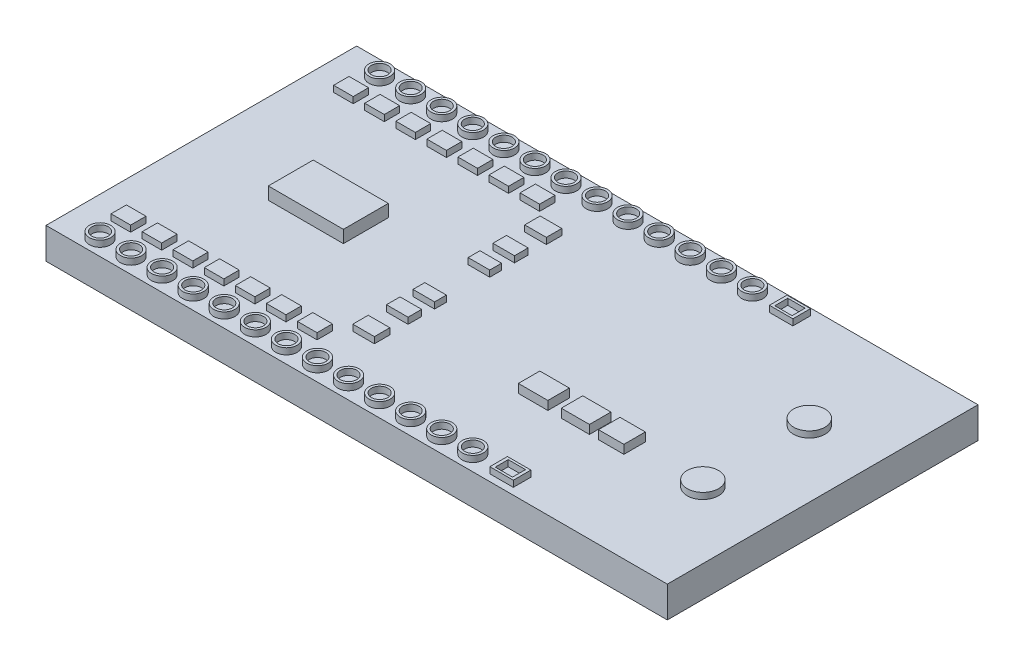
from build123d import *

# Parameters (mm, degrees)
SKETCH1_W           = 50
SKETCH1_H           = 25
BOSS_EXTRUDE1_DEPTH = 2.5
SKETCH2_R           = 0.858035348
SKETCH2_R_2         = 0.658546008
SKETCH2_R_3         = 1.264768735
SKETCH2_W           = 1.886042072
SKETCH2_H           = 1.41485527
SKETCH2_W_2         = 1.393060959
SKETCH2_H_2         = 1.045034821
SKETCH2_W_3         = 1.574978579
SKETCH2_H_3         = 1.234694693
SKETCH2_W_4         = 1.738750891
SKETCH2_H_4         = 1.242501406
SKETCH2_H_5         = 1.09279236
SKETCH2_H_6         = 0.95172598
BOSS_EXTRUDE2_DEPTH = 0.5
SKETCH3_W           = 6.042421404
SKETCH3_H           = 3.614662804
BOSS_EXTRUDE3_DEPTH = 1
SKETCH4_W           = 2.373808409
SKETCH4_H           = 1.726406116
SKETCH4_W_2         = 2.265908026
SKETCH4_W_3         = 2.040115156
BOSS_EXTRUDE4_DEPTH = 0.7


with BuildPart() as part:
    # Sketch1 → Boss-Extrude1 (new body)
    with BuildSketch(Plane(origin=(0, 0, 0), x_dir=(1, 0, 0), z_dir=(0, 1, 0))):
        Rectangle(SKETCH1_W, SKETCH1_H)
    extrude(amount=BOSS_EXTRUDE1_DEPTH)

    # Sketch2 → Boss-Extrude2 (add)
    # profile 1 of 50: a face of its own
    with BuildSketch(Plane(origin=(0, 2.5, 0), x_dir=(1, 0, 0), z_dir=(0, 1, 0))):
        with Locations(Location((-21.903777588, 11.248614845, 0), (0, 0, 270))):
            Circle(SKETCH2_R)
        with Locations(Location((-21.903777588, 11.248614845, 0), (0, 0, 270))):
            Circle(SKETCH2_R_2, mode=Mode.SUBTRACT)
    # profile 2 of 50: a face of its own
    with BuildSketch(Plane(origin=(0, 2.5, 0), x_dir=(1, 0, 0), z_dir=(0, 1, 0))):
        with Locations(Location((-19.403777588, 11.248614845, 0), (0, 0, 270))):
            Circle(SKETCH2_R)
        with Locations(Location((-19.403777588, 11.248614845, 0), (0, 0, 270))):
            Circle(SKETCH2_R_2, mode=Mode.SUBTRACT)
    # profile 3 of 50: a face of its own
    with BuildSketch(Plane(origin=(0, 2.5, 0), x_dir=(1, 0, 0), z_dir=(0, 1, 0))):
        with Locations(Location((-16.903777588, 11.248614845, 0), (0, 0, 270))):
            Circle(SKETCH2_R)
        with Locations(Location((-16.903777588, 11.248614845, 0), (0, 0, 270))):
            Circle(SKETCH2_R_2, mode=Mode.SUBTRACT)
    # profile 4 of 50: a face of its own
    with BuildSketch(Plane(origin=(0, 2.5, 0), x_dir=(1, 0, 0), z_dir=(0, 1, 0))):
        with Locations(Location((-14.403777588, 11.248614845, 0), (0, 0, 270))):
            Circle(SKETCH2_R)
        with Locations(Location((-14.403777588, 11.248614845, 0), (0, 0, 270))):
            Circle(SKETCH2_R_2, mode=Mode.SUBTRACT)
    # profile 5 of 50: a face of its own
    with BuildSketch(Plane(origin=(0, 2.5, 0), x_dir=(1, 0, 0), z_dir=(0, 1, 0))):
        with Locations(Location((-11.903777588, 11.248614845, 0), (0, 0, 270))):
            Circle(SKETCH2_R)
        with Locations(Location((-11.903777588, 11.248614845, 0), (0, 0, 270))):
            Circle(SKETCH2_R_2, mode=Mode.SUBTRACT)
    # profile 6 of 50: a face of its own
    with BuildSketch(Plane(origin=(0, 2.5, 0), x_dir=(1, 0, 0), z_dir=(0, 1, 0))):
        with Locations(Location((-9.403777588, 11.248614845, 0), (0, 0, 270))):
            Circle(SKETCH2_R)
        with Locations(Location((-9.403777588, 11.248614845, 0), (0, 0, 270))):
            Circle(SKETCH2_R_2, mode=Mode.SUBTRACT)
    # profile 7 of 50: a face of its own
    with BuildSketch(Plane(origin=(0, 2.5, 0), x_dir=(1, 0, 0), z_dir=(0, 1, 0))):
        with Locations(Location((-6.903777588, 11.248614845, 0), (0, 0, 270))):
            Circle(SKETCH2_R)
        with Locations(Location((-6.903777588, 11.248614845, 0), (0, 0, 270))):
            Circle(SKETCH2_R_2, mode=Mode.SUBTRACT)
    # profile 8 of 50: a face of its own
    with BuildSketch(Plane(origin=(0, 2.5, 0), x_dir=(1, 0, 0), z_dir=(0, 1, 0))):
        with Locations(Location((-4.403777588, 11.248614845, 0), (0, 0, 270))):
            Circle(SKETCH2_R)
        with Locations(Location((-4.403777588, 11.248614845, 0), (0, 0, 270))):
            Circle(SKETCH2_R_2, mode=Mode.SUBTRACT)
    # profile 9 of 50: a face of its own
    with BuildSketch(Plane(origin=(0, 2.5, 0), x_dir=(1, 0, 0), z_dir=(0, 1, 0))):
        with Locations(Location((-1.903777588, 11.248614845, 0), (0, 0, 270))):
            Circle(SKETCH2_R)
        with Locations(Location((-1.903777588, 11.248614845, 0), (0, 0, 270))):
            Circle(SKETCH2_R_2, mode=Mode.SUBTRACT)
    # profile 10 of 50: a face of its own
    with BuildSketch(Plane(origin=(0, 2.5, 0), x_dir=(1, 0, 0), z_dir=(0, 1, 0))):
        with Locations(Location((0.596222412, 11.248614845, 0), (0, 0, 270))):
            Circle(SKETCH2_R)
        with Locations(Location((0.596222412, 11.248614845, 0), (0, 0, 270))):
            Circle(SKETCH2_R_2, mode=Mode.SUBTRACT)
    # profile 11 of 50: a face of its own
    with BuildSketch(Plane(origin=(0, 2.5, 0), x_dir=(1, 0, 0), z_dir=(0, 1, 0))):
        with Locations(Location((3.096222412, 11.248614845, 0), (0, 0, 270))):
            Circle(SKETCH2_R)
        with Locations(Location((3.096222412, 11.248614845, 0), (0, 0, 270))):
            Circle(SKETCH2_R_2, mode=Mode.SUBTRACT)
    # profile 12 of 50: a face of its own
    with BuildSketch(Plane(origin=(0, 2.5, 0), x_dir=(1, 0, 0), z_dir=(0, 1, 0))):
        with Locations(Location((5.596222412, 11.248614845, 0), (0, 0, 270))):
            Circle(SKETCH2_R)
        with Locations(Location((5.596222412, 11.248614845, 0), (0, 0, 270))):
            Circle(SKETCH2_R_2, mode=Mode.SUBTRACT)
    # profile 13 of 50: a face of its own
    with BuildSketch(Plane(origin=(0, 2.5, 0), x_dir=(1, 0, 0), z_dir=(0, 1, 0))):
        with Locations(Location((8.096222412, 11.248614845, 0), (0, 0, 270))):
            Circle(SKETCH2_R)
        with Locations(Location((8.096222412, 11.248614845, 0), (0, 0, 270))):
            Circle(SKETCH2_R_2, mode=Mode.SUBTRACT)
    # profile 14 of 50: a face of its own
    with BuildSketch(Plane(origin=(0, 2.5, 0), x_dir=(1, 0, 0), z_dir=(0, 1, 0))):
        with Locations(Location((-9.403777588, -11.248614845, 0), (0, 0, 90))):
            Circle(SKETCH2_R)
        with Locations(Location((-9.403777588, -11.248614845, 0), (0, 0, 90))):
            Circle(SKETCH2_R_2, mode=Mode.SUBTRACT)
    # profile 15 of 50: a face of its own
    with BuildSketch(Plane(origin=(0, 2.5, 0), x_dir=(1, 0, 0), z_dir=(0, 1, 0))):
        with Locations(Location((-11.903777588, -11.248614845, 0), (0, 0, 90))):
            Circle(SKETCH2_R)
        with Locations(Location((-11.903777588, -11.248614845, 0), (0, 0, 90))):
            Circle(SKETCH2_R_2, mode=Mode.SUBTRACT)
    # profile 16 of 50: a face of its own
    with BuildSketch(Plane(origin=(0, 2.5, 0), x_dir=(1, 0, 0), z_dir=(0, 1, 0))):
        with Locations(Location((-14.403777588, -11.248614845, 0), (0, 0, 90))):
            Circle(SKETCH2_R)
        with Locations(Location((-14.403777588, -11.248614845, 0), (0, 0, 90))):
            Circle(SKETCH2_R_2, mode=Mode.SUBTRACT)
    # profile 17 of 50: a face of its own
    with BuildSketch(Plane(origin=(0, 2.5, 0), x_dir=(1, 0, 0), z_dir=(0, 1, 0))):
        with Locations(Location((-16.903777588, -11.248614845, 0), (0, 0, 90))):
            Circle(SKETCH2_R)
        with Locations(Location((-16.903777588, -11.248614845, 0), (0, 0, 90))):
            Circle(SKETCH2_R_2, mode=Mode.SUBTRACT)
    # profile 18 of 50: a face of its own
    with BuildSketch(Plane(origin=(0, 2.5, 0), x_dir=(1, 0, 0), z_dir=(0, 1, 0))):
        with Locations(Location((-19.403777588, -11.248614845, 0), (0, 0, 90))):
            Circle(SKETCH2_R)
        with Locations(Location((-19.403777588, -11.248614845, 0), (0, 0, 90))):
            Circle(SKETCH2_R_2, mode=Mode.SUBTRACT)
    # profile 19 of 50: a face of its own
    with BuildSketch(Plane(origin=(0, 2.5, 0), x_dir=(1, 0, 0), z_dir=(0, 1, 0))):
        with Locations(Location((-21.903777588, -11.248614845, 0), (0, 0, 90))):
            Circle(SKETCH2_R)
        with Locations(Location((-21.903777588, -11.248614845, 0), (0, 0, 90))):
            Circle(SKETCH2_R_2, mode=Mode.SUBTRACT)
    # profile 20 of 50: a face of its own
    with BuildSketch(Plane(origin=(0, 2.5, 0), x_dir=(1, 0, 0), z_dir=(0, 1, 0))):
        with Locations(Location((5.596222412, -11.248614845, 0), (0, 0, 90))):
            Circle(SKETCH2_R)
        with Locations(Location((5.596222412, -11.248614845, 0), (0, 0, 90))):
            Circle(SKETCH2_R_2, mode=Mode.SUBTRACT)
    # profile 21 of 50: a face of its own
    with BuildSketch(Plane(origin=(0, 2.5, 0), x_dir=(1, 0, 0), z_dir=(0, 1, 0))):
        with Locations(Location((8.096222412, -11.248614845, 0), (0, 0, 90))):
            Circle(SKETCH2_R)
        with Locations(Location((8.096222412, -11.248614845, 0), (0, 0, 90))):
            Circle(SKETCH2_R_2, mode=Mode.SUBTRACT)
    # profile 22 of 50: a face of its own
    with BuildSketch(Plane(origin=(0, 2.5, 0), x_dir=(1, 0, 0), z_dir=(0, 1, 0))):
        with Locations(Location((3.096222412, -11.248614845, 0), (0, 0, 90))):
            Circle(SKETCH2_R)
        with Locations(Location((3.096222412, -11.248614845, 0), (0, 0, 90))):
            Circle(SKETCH2_R_2, mode=Mode.SUBTRACT)
    # profile 23 of 50: a face of its own
    with BuildSketch(Plane(origin=(0, 2.5, 0), x_dir=(1, 0, 0), z_dir=(0, 1, 0))):
        with Locations(Location((0.596222412, -11.248614845, 0), (0, 0, 90))):
            Circle(SKETCH2_R)
        with Locations(Location((0.596222412, -11.248614845, 0), (0, 0, 90))):
            Circle(SKETCH2_R_2, mode=Mode.SUBTRACT)
    # profile 24 of 50: a face of its own
    with BuildSketch(Plane(origin=(0, 2.5, 0), x_dir=(1, 0, 0), z_dir=(0, 1, 0))):
        with Locations(Location((-1.903777588, -11.248614845, 0), (0, 0, 90))):
            Circle(SKETCH2_R)
        with Locations(Location((-1.903777588, -11.248614845, 0), (0, 0, 90))):
            Circle(SKETCH2_R_2, mode=Mode.SUBTRACT)
    # profile 25 of 50: a face of its own
    with BuildSketch(Plane(origin=(0, 2.5, 0), x_dir=(1, 0, 0), z_dir=(0, 1, 0))):
        with Locations(Location((-4.403777588, -11.248614845, 0), (0, 0, 90))):
            Circle(SKETCH2_R)
        with Locations(Location((-4.403777588, -11.248614845, 0), (0, 0, 90))):
            Circle(SKETCH2_R_2, mode=Mode.SUBTRACT)
    # profile 26 of 50: a face of its own
    with BuildSketch(Plane(origin=(0, 2.5, 0), x_dir=(1, 0, 0), z_dir=(0, 1, 0))):
        with Locations(Location((-6.903777588, -11.248614845, 0), (0, 0, 90))):
            Circle(SKETCH2_R)
        with Locations(Location((-6.903777588, -11.248614845, 0), (0, 0, 90))):
            Circle(SKETCH2_R_2, mode=Mode.SUBTRACT)
    # profile 27 of 50: a face of its own
    with BuildSketch(Plane(origin=(0, 2.5, 0), x_dir=(1, 0, 0), z_dir=(0, 1, 0))):
        with Locations(Location((19.642223726, 4.282710717, 0), (0, 0, 270))):
            Circle(SKETCH2_R_3)
    # profile 28 of 50: a face of its own
    with BuildSketch(Plane(origin=(0, 2.5, 0), x_dir=(1, 0, 0), z_dir=(0, 1, 0))):
        with Locations(Location((19.642223726, -4.282710717, 0), (0, 0, 90))):
            Circle(SKETCH2_R_3)
    # profile 29 of 50: a face of its own
    with BuildSketch(Plane(origin=(0, 2.5, 0), x_dir=(1, 0, 0), z_dir=(0, 1, 0))):
        with Locations((11.117000575, 11.248614845)):
            Rectangle(SKETCH2_W, SKETCH2_H)
        with Locations((11.117000576, 11.248614846)):
            Rectangle(SKETCH2_W_2, SKETCH2_H_2, mode=Mode.SUBTRACT)
    # profile 30 of 50: a face of its own
    with BuildSketch(Plane(origin=(0, 2.5, 0), x_dir=(1, 0, 0), z_dir=(0, 1, 0))):
        with Locations((11.117000575, -11.248614845)):
            Rectangle(SKETCH2_W, SKETCH2_H)
        with Locations((11.117000576, -11.248614846)):
            Rectangle(SKETCH2_W_2, SKETCH2_H_2, mode=Mode.SUBTRACT)
    # profile 31 of 50: a face of its own
    with BuildSketch(Plane(origin=(0, 2.5, 0), x_dir=(1, 0, 0), z_dir=(0, 1, 0))):
        with Locations((-19.403777588, 8.956286559)):
            Rectangle(SKETCH2_W_3, SKETCH2_H_3)
    # profile 32 of 50: a face of its own
    with BuildSketch(Plane(origin=(0, 2.5, 0), x_dir=(1, 0, 0), z_dir=(0, 1, 0))):
        with Locations((-21.903777588, 8.956286559)):
            Rectangle(SKETCH2_W_3, SKETCH2_H_3)
    # profile 33 of 50: a face of its own
    with BuildSketch(Plane(origin=(0, 2.5, 0), x_dir=(1, 0, 0), z_dir=(0, 1, 0))):
        with Locations((-16.903777588, 8.956286559)):
            Rectangle(SKETCH2_W_3, SKETCH2_H_3)
    # profile 34 of 50: a face of its own
    with BuildSketch(Plane(origin=(0, 2.5, 0), x_dir=(1, 0, 0), z_dir=(0, 1, 0))):
        with Locations((-14.403777589, 8.956286559)):
            Rectangle(SKETCH2_W_3, SKETCH2_H_3)
    # profile 35 of 50: a face of its own
    with BuildSketch(Plane(origin=(0, 2.5, 0), x_dir=(1, 0, 0), z_dir=(0, 1, 0))):
        with Locations((-11.903777589, 8.956286559)):
            Rectangle(SKETCH2_W_3, SKETCH2_H_3)
    # profile 36 of 50: a face of its own
    with BuildSketch(Plane(origin=(0, 2.5, 0), x_dir=(1, 0, 0), z_dir=(0, 1, 0))):
        with Locations((-9.403777589, 8.956286559)):
            Rectangle(SKETCH2_W_3, SKETCH2_H_3)
    # profile 37 of 50: a face of its own
    with BuildSketch(Plane(origin=(0, 2.5, 0), x_dir=(1, 0, 0), z_dir=(0, 1, 0))):
        with Locations((-6.903777589, 8.956286559)):
            Rectangle(SKETCH2_W_3, SKETCH2_H_3)
    # profile 38 of 50: a face of its own
    with BuildSketch(Plane(origin=(0, 2.5, 0), x_dir=(1, 0, 0), z_dir=(0, 1, 0))):
        with Locations((-6.903777589, -8.956286559)):
            Rectangle(SKETCH2_W_3, SKETCH2_H_3)
    # profile 39 of 50: a face of its own
    with BuildSketch(Plane(origin=(0, 2.5, 0), x_dir=(1, 0, 0), z_dir=(0, 1, 0))):
        with Locations((-9.403777589, -8.956286559)):
            Rectangle(SKETCH2_W_3, SKETCH2_H_3)
    # profile 40 of 50: a face of its own
    with BuildSketch(Plane(origin=(0, 2.5, 0), x_dir=(1, 0, 0), z_dir=(0, 1, 0))):
        with Locations((-11.903777589, -8.956286559)):
            Rectangle(SKETCH2_W_3, SKETCH2_H_3)
    # profile 41 of 50: a face of its own
    with BuildSketch(Plane(origin=(0, 2.5, 0), x_dir=(1, 0, 0), z_dir=(0, 1, 0))):
        with Locations((-14.403777589, -8.956286559)):
            Rectangle(SKETCH2_W_3, SKETCH2_H_3)
    # profile 42 of 50: a face of its own
    with BuildSketch(Plane(origin=(0, 2.5, 0), x_dir=(1, 0, 0), z_dir=(0, 1, 0))):
        with Locations((-16.903777588, -8.956286559)):
            Rectangle(SKETCH2_W_3, SKETCH2_H_3)
    # profile 43 of 50: a face of its own
    with BuildSketch(Plane(origin=(0, 2.5, 0), x_dir=(1, 0, 0), z_dir=(0, 1, 0))):
        with Locations((-19.403777588, -8.956286559)):
            Rectangle(SKETCH2_W_3, SKETCH2_H_3)
    # profile 44 of 50: a face of its own
    with BuildSketch(Plane(origin=(0, 2.5, 0), x_dir=(1, 0, 0), z_dir=(0, 1, 0))):
        with Locations((-21.903777588, -8.956286559)):
            Rectangle(SKETCH2_W_3, SKETCH2_H_3)
    # profile 45 of 50: a face of its own
    with BuildSketch(Plane(origin=(0, 2.5, 0), x_dir=(1, 0, 0), z_dir=(0, 1, 0))):
        with Locations((-4.403777589, -6.917033176)):
            Rectangle(SKETCH2_W_4, SKETCH2_H_4)
    # profile 46 of 50: a face of its own
    with BuildSketch(Plane(origin=(0, 2.5, 0), x_dir=(1, 0, 0), z_dir=(0, 1, 0))):
        with Locations((-4.403777589, 6.917033176)):
            Rectangle(SKETCH2_W_4, SKETCH2_H_4)
    # profile 47 of 50: a face of its own
    with BuildSketch(Plane(origin=(0, 2.5, 0), x_dir=(1, 0, 0), z_dir=(0, 1, 0))):
        with Locations((-4.403777589, 4.282710717)):
            Rectangle(SKETCH2_W_4, SKETCH2_H_5)
    # profile 48 of 50: a face of its own
    with BuildSketch(Plane(origin=(0, 2.5, 0), x_dir=(1, 0, 0), z_dir=(0, 1, 0))):
        with Locations((-4.403777589, 2.219544969)):
            Rectangle(SKETCH2_W_4, SKETCH2_H_6)
    # profile 49 of 50: a face of its own
    with BuildSketch(Plane(origin=(0, 2.5, 0), x_dir=(1, 0, 0), z_dir=(0, 1, 0))):
        with Locations((-4.403777589, -4.282710717)):
            Rectangle(SKETCH2_W_4, SKETCH2_H_5)
    # profile 50 of 50: a face of its own
    with BuildSketch(Plane(origin=(0, 2.5, 0), x_dir=(1, 0, 0), z_dir=(0, 1, 0))):
        with Locations((-4.403777589, -2.219544969)):
            Rectangle(SKETCH2_W_4, SKETCH2_H_6)
    extrude(amount=BOSS_EXTRUDE2_DEPTH)

    # Sketch3 → Boss-Extrude3 (add)
    with BuildSketch(Plane(origin=(0, 2.5, 0), x_dir=(1, 0, 0), z_dir=(0, 1, 0))):
        with Locations((-14.782352363, 0)):
            Rectangle(SKETCH3_W, SKETCH3_H)
    extrude(amount=BOSS_EXTRUDE3_DEPTH)

    # Sketch4 → Boss-Extrude4 (add)
    with BuildSketch(Plane(origin=(0, 2.5, 0), x_dir=(1, 0, 0), z_dir=(0, 1, 0))):
        with Locations((6.905624462, -4.342990384)):
            Rectangle(SKETCH4_W, SKETCH4_H)
        with Locations((10.304486501, -4.342990384)):
            Rectangle(SKETCH4_W_2, SKETCH4_H)
        with Locations((13.189315815, -4.342990384)):
            Rectangle(SKETCH4_W_3, SKETCH4_H)
    extrude(amount=BOSS_EXTRUDE4_DEPTH)


solid = part.part
